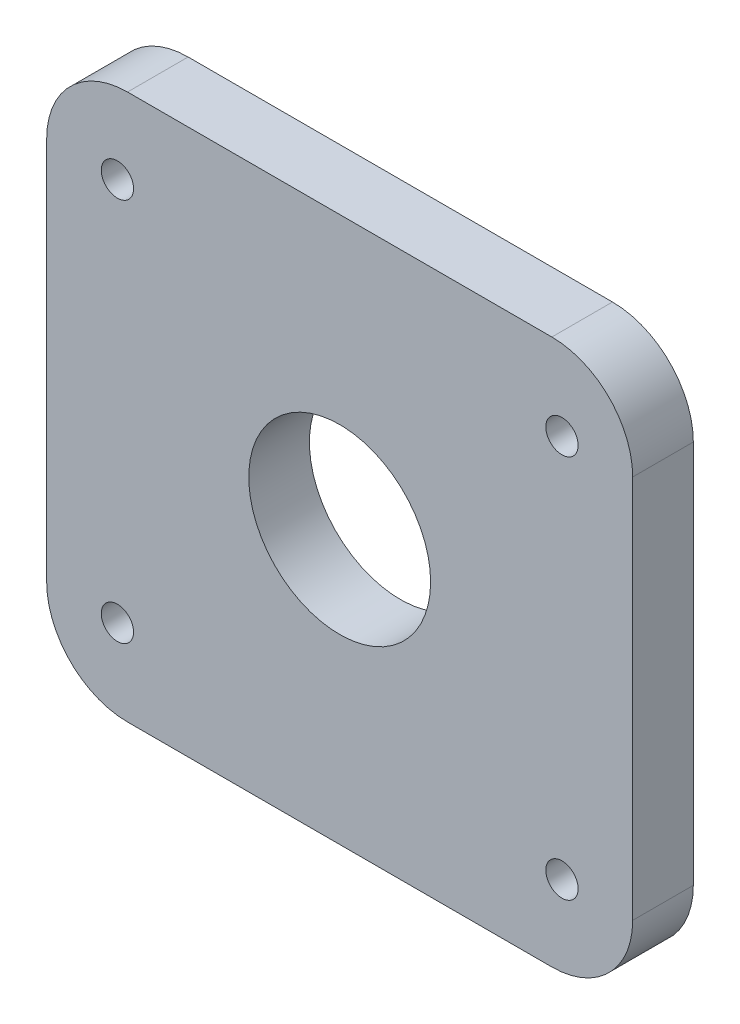
from build123d import *

# Parameters (mm, degrees)
EXTRUDE_1_DEPTH     = 3
SKETCH_2_R          = 4.5
CUT_EXTRUDE_1_DEPTH = 40.736632973
SKETCH_3_R          = 0.8
CUT_EXTRUDE_2_DEPTH = 40.736632973


with BuildPart() as part:
    # Эскиз1 → Бобышка-Вытянуть1 (new body)
    with BuildSketch(Plane.XY):
        with BuildLine():
            Line((4, 0), (25, 0))
            ThreePointArc((25, 0), (27.828427125, 1.171572875), (29, 4))
            Line((29, 4), (29, 23))
            ThreePointArc((29, 23), (27.828427125, 25.828427125), (25, 27))
            Line((25, 27), (4, 27))
            ThreePointArc((4, 27), (1.171572875, 25.828427125), (0, 23))
            Line((0, 23), (0, 4))
            ThreePointArc((0, 4), (1.171572875, 1.171572875), (4, 0))
        make_face()
    extrude(amount=EXTRUDE_1_DEPTH)

    # Эскиз2 → Вырез-Вытянуть1 (cut, through all)
    with BuildSketch(Plane.XY.offset(3)):
        with Locations((14.5, 13.5)):
            Circle(SKETCH_2_R)
    extrude(amount=-CUT_EXTRUDE_1_DEPTH, mode=Mode.SUBTRACT)

    # Эскиз3 → Вырез-Вытянуть2 (cut, through all)
    with BuildSketch(Plane.XY.offset(3)):
        with Locations((3.5, 4)):
            Circle(SKETCH_3_R)
        with Locations((25.5, 4)):
            Circle(SKETCH_3_R)
        with Locations((25.5, 23)):
            Circle(SKETCH_3_R)
        with Locations((3.5, 23)):
            Circle(SKETCH_3_R)
    extrude(amount=-CUT_EXTRUDE_2_DEPTH, mode=Mode.SUBTRACT)


solid = part.part
